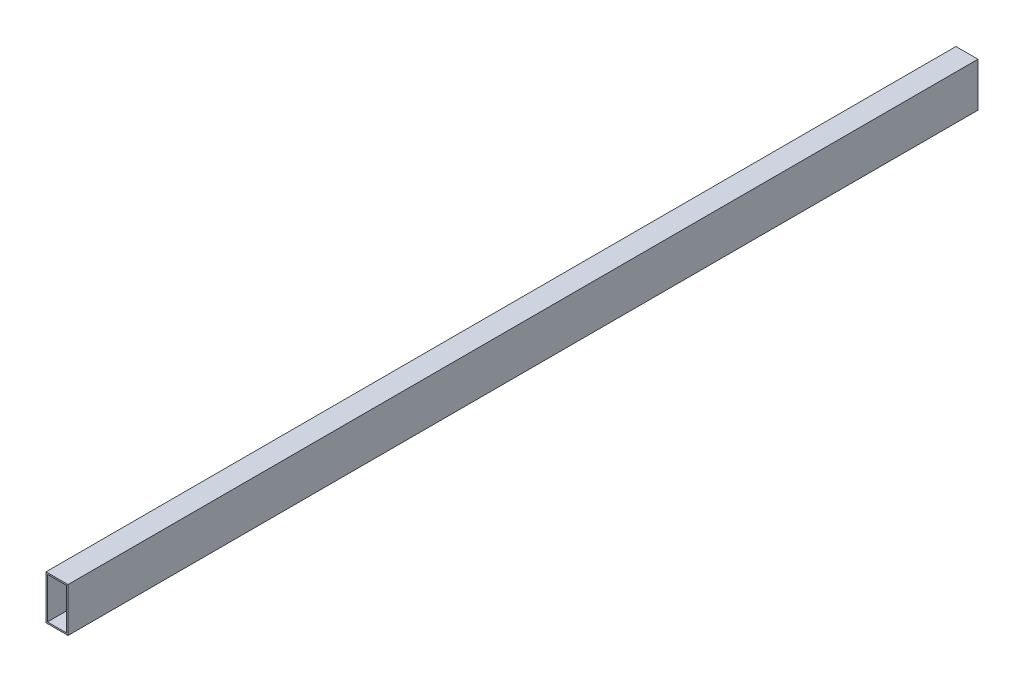
from build123d import *

# Parameters (mm, degrees)
SKETCH1_W           = 25.4
SKETCH1_H           = 50.8
BOSS_EXTRUDE1_DEPTH = 1047.75
SKETCH2_W           = 22.098
SKETCH2_H           = 47.498
CUT_EXTRUDE1_DEPTH  = 1050.303688466


with BuildPart() as part:
    # Sketch1 → Boss-Extrude1 (new body)
    with BuildSketch(Plane.XY):
        with Locations((-35.737209302, -4.799418605)):
            Rectangle(SKETCH1_W, SKETCH1_H)
    extrude(amount=BOSS_EXTRUDE1_DEPTH)

    # Sketch2 → Cut-Extrude1 (cut, through all)
    with BuildSketch(Plane.XY.offset(1047.75)):
        with Locations((-35.737209302, -4.799418605)):
            Rectangle(SKETCH2_W, SKETCH2_H)
    extrude(amount=-CUT_EXTRUDE1_DEPTH, mode=Mode.SUBTRACT)


solid = part.part
